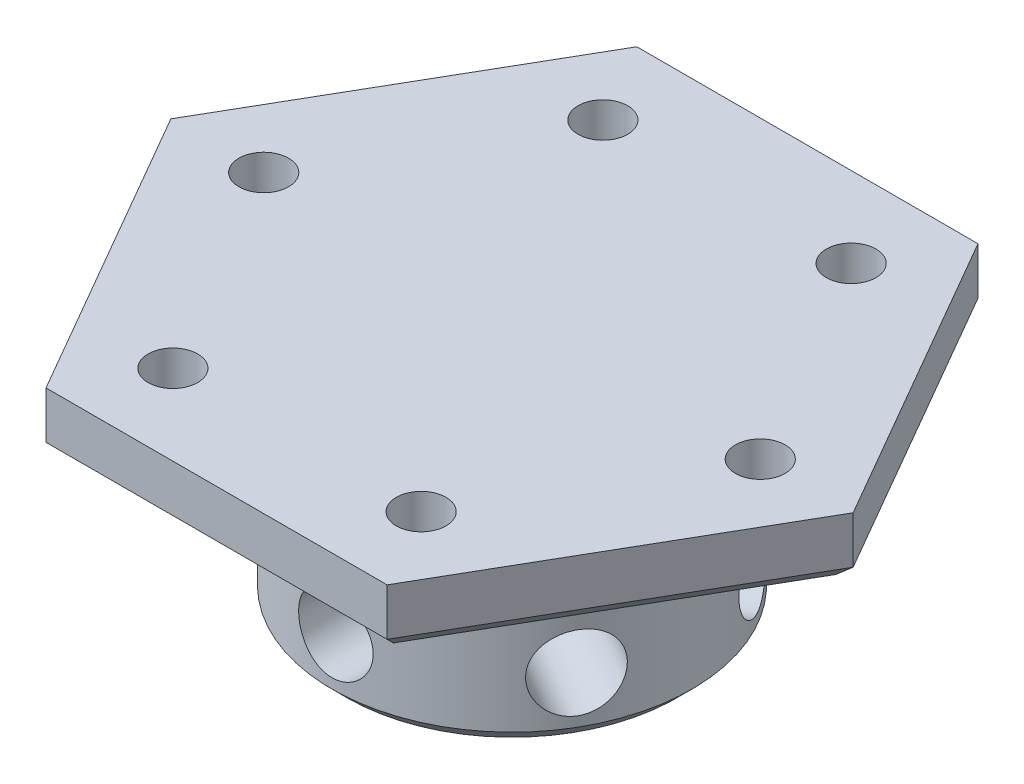
from build123d import *

# Parameters (mm, degrees)
EXTRUDE_1_DEPTH          = 1.25
SKETCH_2_R               = 7.25
EXTRUDE_2_DEPTH          = 7.5
SKETCH_3_R               = 1.5
CUT_EXTRUDE_1_DEPTH      = 32.199772969
PATTERN_CIRCULAR_1_COUNT = 3
CHAMFER_1_SIZE           = 0.6
SKETCH_4_R               = 1
CUT_EXTRUDE_2_DEPTH      = 21.746646315


with BuildPart() as part:
    # 草图1 → 凸台-拉伸1 (new, symmetric)
    with BuildSketch(Plane(origin=(0, 0, 0), x_dir=(1, 0, 0), z_dir=(0, 1, 0))):
        Polygon((13.740936407, 0), (6.870468203, 11.9), (-6.870468203, 11.9), (-13.740936407, 0), (-6.870468203, -11.9), (6.870468203, -11.9), align=None)
    extrude(amount=EXTRUDE_1_DEPTH, both=True)

    # 草图2 → 凸台-拉伸2 (add)
    with BuildSketch(Plane.XZ.offset(1.25)):
        with Locations(Location((0, 0, 0), (0, 0, 270))):
            Circle(SKETCH_2_R)
    extrude(amount=EXTRUDE_2_DEPTH)

    # 草图3 → 切除-拉伸1 (cut, through all)
    with BuildSketch(Plane(origin=(-10.305702305, 0, 5.95), x_dir=(0.5000000000000071, 0, 0.8660254037844346), z_dir=(-0.8660254037844346, 0, 0.5000000000000071))):
        with Locations((0, -6.25)):
            Circle(SKETCH_3_R)
    cut_extrude_1 = extrude(amount=-CUT_EXTRUDE_1_DEPTH, mode=Mode.SUBTRACT)

    # 阵列(圆周)1: 切除-拉伸1 ×3 about axis
    pattern_circular_1_axis = Axis((0, -8.75, 0), (0, -1, 0))
    for i in range(1, PATTERN_CIRCULAR_1_COUNT):
        add(cut_extrude_1.rotate(pattern_circular_1_axis, i * 360 / PATTERN_CIRCULAR_1_COUNT), mode=Mode.SUBTRACT)

    # 倒角1
    chamfer_1_edges = [part.edges().sort_by_distance(p)[0] for p in [
        (0, -8.75, 7.25),
        (0, -1.25, 11.9),
        (-10.305702305, -1.25, 5.95),
        (-10.305702305, -1.25, -5.95),
        (0, -1.25, -11.9),
        (10.305702305, -1.25, -5.95),
        (10.305702305, -1.25, 5.95),
    ]]
    chamfer(chamfer_1_edges, length=CHAMFER_1_SIZE)

    # 草图4 → 切除-拉伸2 (cut, through all)
    with BuildSketch(Plane(origin=(0, 1.25, 0), x_dir=(1, 0, 0), z_dir=(0, 1, 0))):
        with Locations(Location((5, 8.660254038, 0), (0, 0, 270))):
            Circle(SKETCH_4_R)
        with Locations(Location((10, 0, 0), (0, 0, 270))):
            Circle(SKETCH_4_R)
        with Locations(Location((5, -8.660254038, 0), (0, 0, 270))):
            Circle(SKETCH_4_R)
        with Locations(Location((-5, -8.660254038, 0), (0, 0, 270))):
            Circle(SKETCH_4_R)
        with Locations(Location((-10, 0, 0), (0, 0, 270))):
            Circle(SKETCH_4_R)
        with Locations(Location((-5, 8.660254038, 0), (0, 0, 270))):
            Circle(SKETCH_4_R)
    extrude(amount=-CUT_EXTRUDE_2_DEPTH, mode=Mode.SUBTRACT)


solid = part.part
